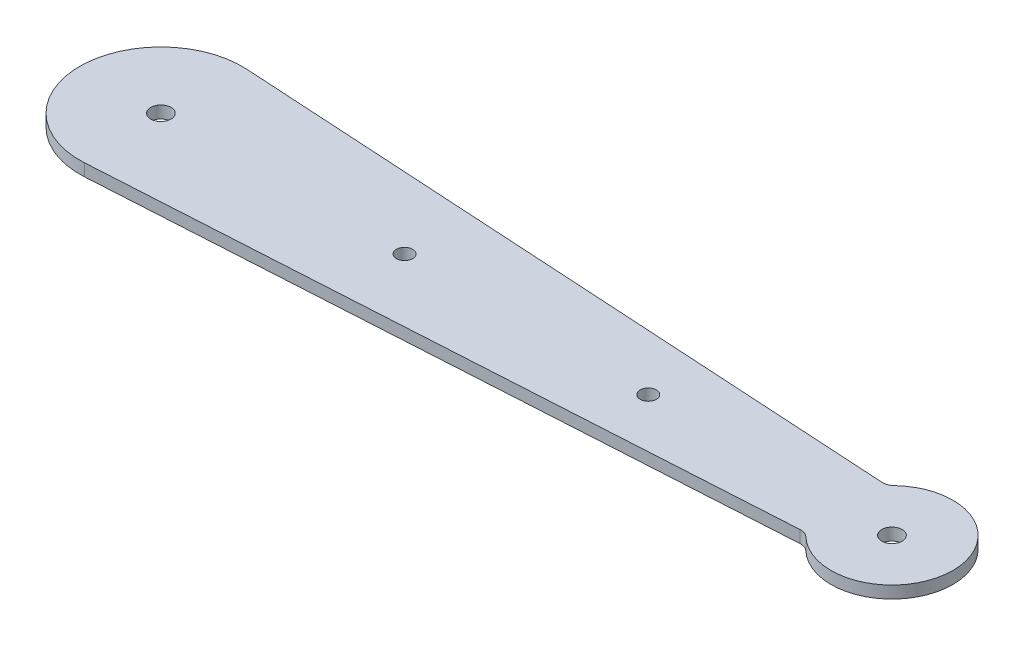
from build123d import *

# Parameters (mm, degrees)
SKETCH1_R           = 2
SKETCH1_R_2         = 2.5
BOSS_EXTRUDE1_DEPTH = 3
FILLET2_R           = 3
FILLET3_R           = 3


with BuildPart() as part:
    # Sketch1 → Boss-Extrude1 (new body)
    with BuildSketch(Plane(origin=(0, 0, 0), x_dir=(1, 0, 0), z_dir=(0, 1, 0))):
        with BuildLine():
            ThreePointArc((1.186783721, 19.964757559), (-20, 0), (1.186783721, -19.964757559))
            Line((1.186783721, -19.964757559), (168.819660113, -10))
            ThreePointArc((168.819660113, -10), (195, 0), (168.819660113, 10))
            Line((168.819660113, 10), (1.186783721, 19.964757559))
        make_face()
        with Locations(Location((60, 0, 0), (0, 0, 270))):
            Circle(SKETCH1_R, mode=Mode.SUBTRACT)
        with Locations(Location((0, 0, 0), (0, 0, 270))):
            Circle(SKETCH1_R_2, mode=Mode.SUBTRACT)
        with Locations(Location((120, 0, 0), (0, 0, 270))):
            Circle(SKETCH1_R, mode=Mode.SUBTRACT)
        with Locations(Location((180, 0, 0), (0, 0, 270))):
            Circle(SKETCH1_R_2, mode=Mode.SUBTRACT)
    extrude(amount=BOSS_EXTRUDE1_DEPTH)

    # Fillet2
    fillet2_edges = [part.edges().sort_by_distance(p)[0] for p in [
        (168.819660113, 1.5, -10),
    ]]
    fillet(fillet2_edges, radius=FILLET2_R)

    # Fillet3
    fillet3_edges = [part.edges().sort_by_distance(p)[0] for p in [
        (168.819660113, 1.5, 10),
    ]]
    fillet(fillet3_edges, radius=FILLET3_R)


solid = part.part
